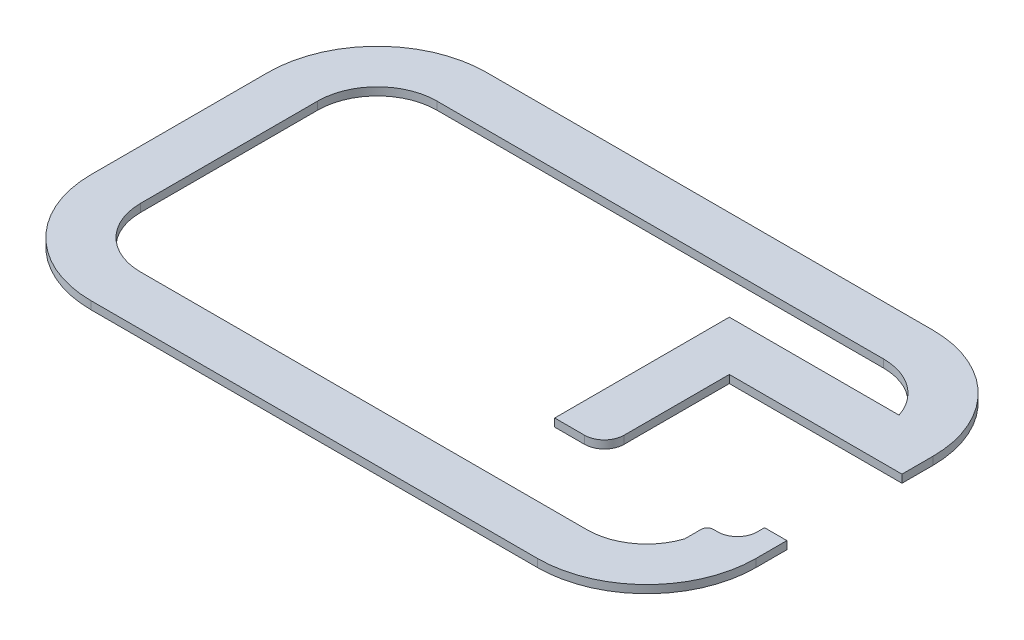
from build123d import *

# Parameters (mm, degrees)
BOSS_EXTRUDE1_DEPTH = 4


with BuildPart() as part:
    # Sketch1 → Boss-Extrude1 (new body)
    with BuildSketch(Plane(origin=(0, 0, 0), x_dir=(1, 0, 0), z_dir=(0, 1, 0))):
        with BuildLine():
            Line((285.295698998, -100.459464193), (285.295698998, -116.089464193))
            ThreePointArc((285.295698998, -116.089464193), (269.186571963, -154.980337158), (230.295698998, -171.089464193))
            Line((230.295698998, -171.089464193), (5.265698998, -171.089464193))
            ThreePointArc((5.265698998, -171.089464193), (-33.625173967, -154.980337158), (-49.734301002, -116.089464193))
            Line((-49.734301002, -116.089464193), (-49.734301002, -26.829464193))
            ThreePointArc((-49.734301002, -26.829464193), (-33.625173967, 12.061408773), (5.265698998, 28.170535807))
            Line((5.265698998, 28.170535807), (230.295698998, 28.170535807))
            ThreePointArc((230.295698998, 28.170535807), (269.186571963, 12.061408773), (285.295698998, -26.829464193))
            Line((285.295698998, -26.829464193), (285.295698998, -42.459464193))
            Line((285.295698998, -42.459464193), (198.295698998, -42.459464193))
            Line((198.295698998, -42.459464193), (198.295698998, -95.459464193))
            ThreePointArc((198.295698998, -95.459464193), (195.36676681, -102.530532004), (188.295698998, -105.459464193))
            Line((188.295698998, -105.459464193), (173.295698998, -105.459464193))
            Line((173.295698998, -105.459464193), (173.295698998, -17.459464193))
            Line((173.295698998, -17.459464193), (258.794876179, -17.459464193))
            ThreePointArc((258.794876179, -17.459464193), (247.886889975, -2.528229656), (230.295698998, 3.170535807))
            Line((230.295698998, 3.170535807), (5.265698998, 3.170535807))
            ThreePointArc((5.265698998, 3.170535807), (-15.947504438, -5.616260757), (-24.734301002, -26.829464193))
            Line((-24.734301002, -26.829464193), (-24.734301002, -116.089464193))
            ThreePointArc((-24.734301002, -116.089464193), (-15.947504438, -137.302667628), (5.265698998, -146.089464193))
            Line((5.265698998, -146.089464193), (230.295698998, -146.089464193))
            ThreePointArc((230.295698998, -146.089464193), (247.886889975, -140.390698729), (258.794876179, -125.459464193))
            Line((258.794876179, -125.459464193), (258.794876179, -117.089464193))
            ThreePointArc((258.794876179, -117.089464193), (259.673555836, -114.968143849), (261.794876179, -114.089464193))
            Line((261.794876179, -114.089464193), (264.045287589, -114.089464193))
            ThreePointArc((264.045287589, -114.089464193), (271.1163554, -111.160532004), (274.045287589, -104.089464193))
            Line((274.045287589, -104.089464193), (274.045287589, -100.459464193))
            Line((274.045287589, -100.459464193), (285.295698998, -100.459464193))
        make_face()
    extrude(amount=BOSS_EXTRUDE1_DEPTH)


solid = part.part
